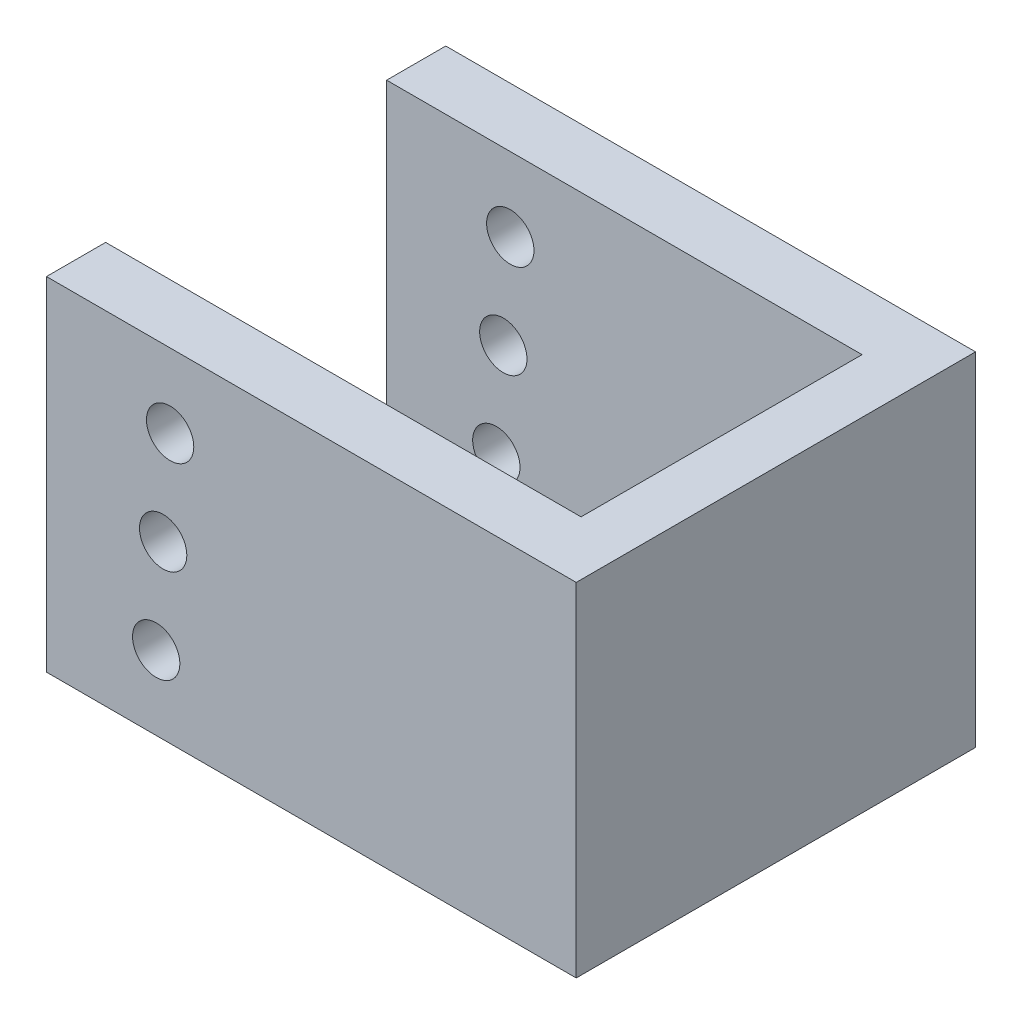
from build123d import *

# Parameters (mm, degrees)
SALIENTE_EXTRUIR1_DEPTH   = 2
SALIENTE_EXTRUIR2_DEPTH   = 11.5
CROQUIS3_W                = 17.909938215
CROQUIS3_H                = 11.583193085
SALIENTE_EXTRUIR3_DEPTH   = 2
TALADRO_ROSCADO_M21_D     = 1.6
TALADRO_ROSCADO_M21_DEPTH = 17
TALADRO_ROSCADO_M21_TIP   = 0.480688495


with BuildPart() as part:
    # Croquis1 → Saliente-Extruir1 (new body)
    with BuildSketch(Plane.XY.offset(-8.1)):
        Polygon((-4.56285844, -53.408133883), (-6.500165269, -64.991326968), (-20.63641004, -64.991326968), (-20.63641004, -53.408133883), align=None)
    extrude(amount=SALIENTE_EXTRUIR1_DEPTH)

    # Croquis2 → Saliente-Extruir2 (add)
    with BuildSketch(Plane.XY.offset(-6.1)):
        Polygon((-4.56285844, -53.408133883), (-2.726471825, -53.408133883), (-2.726471825, -64.991326968), (-6.500165269, -64.991326968), align=None)
    extrude(amount=-SALIENTE_EXTRUIR2_DEPTH)

    # Croquis3 → Saliente-Extruir3 (add)
    with BuildSketch(Plane(origin=(0, 0, -17.6), x_dir=(-1, 0, 0), z_dir=(0, 0, -1))):
        with Locations((11.681440933, -59.199730426)):
            Rectangle(CROQUIS3_W, CROQUIS3_H)
    extrude(amount=SALIENTE_EXTRUIR3_DEPTH)

    # Taladro roscado M21
    with Locations(Plane.XY.offset(-6.1)):
        with Locations((-16.926929895, -62.491326968), (-16.691574413, -59.199730426), (-16.456218931, -55.908133883)):
            Hole(TALADRO_ROSCADO_M21_D / 2, depth=TALADRO_ROSCADO_M21_DEPTH)
            with Locations((0, 0, -(TALADRO_ROSCADO_M21_DEPTH + TALADRO_ROSCADO_M21_TIP / 2))):  # 118° drill point
                Cone(0, TALADRO_ROSCADO_M21_D / 2, TALADRO_ROSCADO_M21_TIP, mode=Mode.SUBTRACT)


solid = part.part
